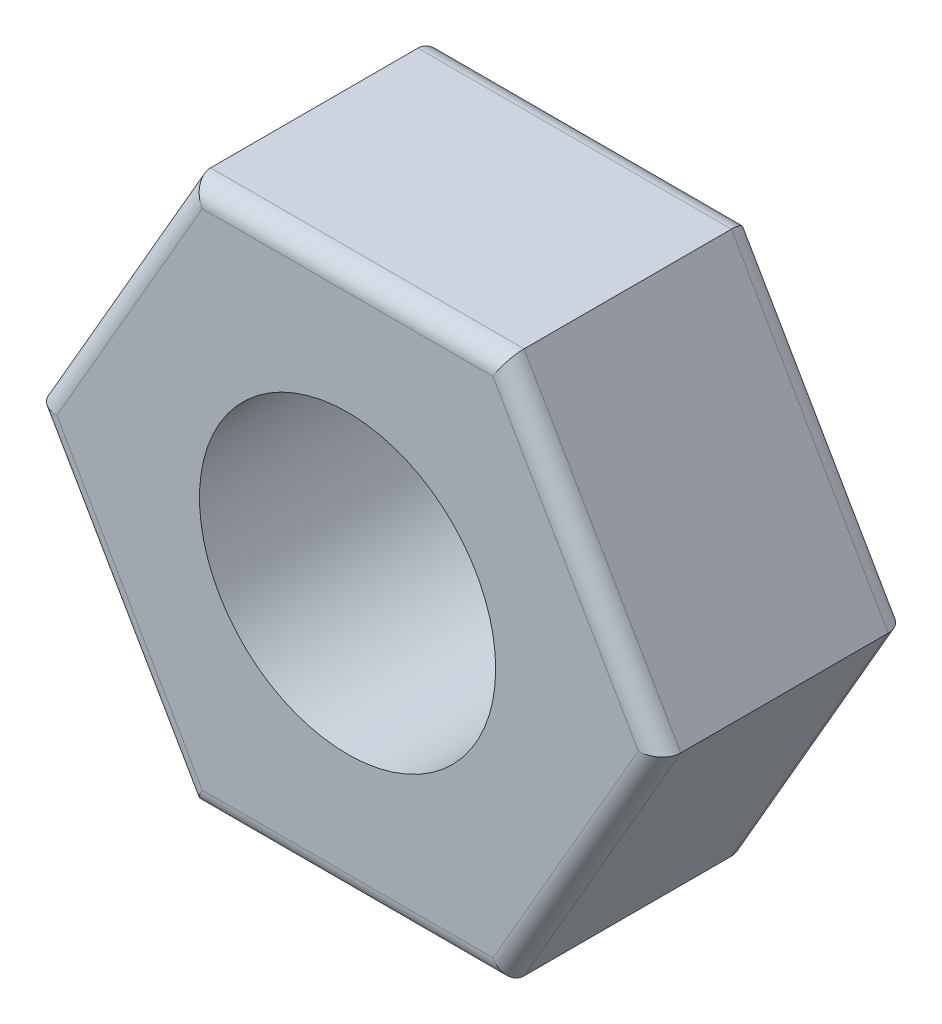
from build123d import *

# Parameters (mm, degrees)
SKETCH_1_R      = 1.5
EXTRUDE_1_DEPTH = 2.5
FILLET_1_R      = 0.2


with BuildPart() as part:
    # 草图1 → 凸台-拉伸1 (new body)
    with BuildSketch(Plane.XY):
        Polygon((1.58771324, -2.75), (3.175426481, 0), (1.58771324, 2.75), (-1.58771324, 2.75), (-3.175426481, 0), (-1.58771324, -2.75), align=None)
        Circle(SKETCH_1_R, mode=Mode.SUBTRACT)
    extrude(amount=EXTRUDE_1_DEPTH)

    # 圆角1
    fillet_1_edges = [part.edges().sort_by_distance(p)[0] for p in [
        (2.38156986, 1.375, 2.5),
        (0, 2.75, 2.5),
        (-1.5, 0, 0),
        (-2.38156986, 1.375, 2.5),
        (-2.38156986, -1.375, 2.5),
        (0, -2.75, 2.5),
        (-2.38156986, -1.375, 0),
        (-2.38156986, 1.375, 0),
        (0, 2.75, 0),
        (2.38156986, 1.375, 0),
        (2.38156986, -1.375, 0),
        (0, -2.75, 0),
        (2.38156986, -1.375, 2.5),
    ]]
    fillet(fillet_1_edges, radius=FILLET_1_R)


solid = part.part
